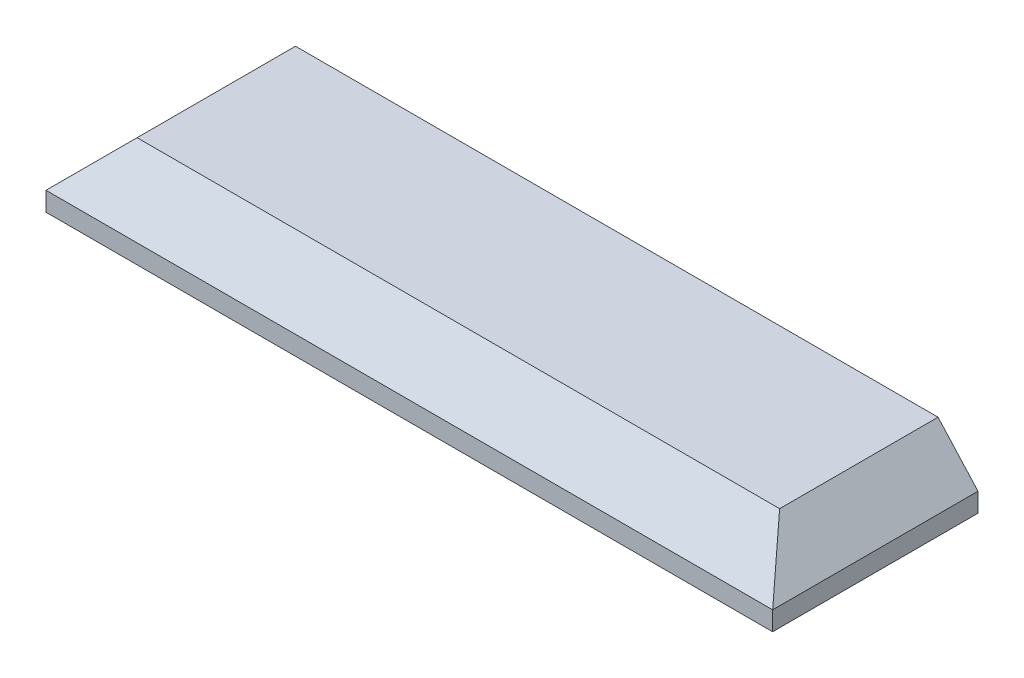
from build123d import *

# Parameters (mm, degrees)
SKETCH1_W           = 46
SKETCH1_H           = 4
BOSS_EXTRUDE1_DEPTH = 13
CUT_EXTRUDE1_DEPTH  = 46
CUT_EXTRUDE2_DEPTH  = 46
CUT_EXTRUDE3_DEPTH  = 46


with BuildPart() as part:
    # Sketch1 → Boss-Extrude1 (new body)
    with BuildSketch(Plane.XY):
        with Locations((23, 2)):
            Rectangle(SKETCH1_W, SKETCH1_H)
    extrude(amount=BOSS_EXTRUDE1_DEPTH)

    # Sketch2 → Cut-Extrude1 (cut)
    with BuildSketch(Plane(origin=(46, 0, 0), x_dir=(0, 0, -1), z_dir=(1, 0, 0))):
        Polygon((-10.029675263, 4), (-13, 1.204486068), (-13, 4), align=None)
    extrude(amount=-CUT_EXTRUDE1_DEPTH, mode=Mode.SUBTRACT)

    # Sketch3 → Cut-Extrude2 (cut)
    with BuildSketch(Plane.XY.offset(13)):
        Polygon((46, 1.204486068), (43.471571356, 4), (46, 4), align=None)
    extrude(amount=-CUT_EXTRUDE2_DEPTH, mode=Mode.SUBTRACT)

    # Sketch4 → Cut-Extrude3 (cut)
    with BuildSketch(Plane.XY.offset(13)):
        Polygon((0, 1.204486068), (3.068298022, 4.272784089), (0, 4.272784089), align=None)
    extrude(amount=-CUT_EXTRUDE3_DEPTH, mode=Mode.SUBTRACT)


solid = part.part
